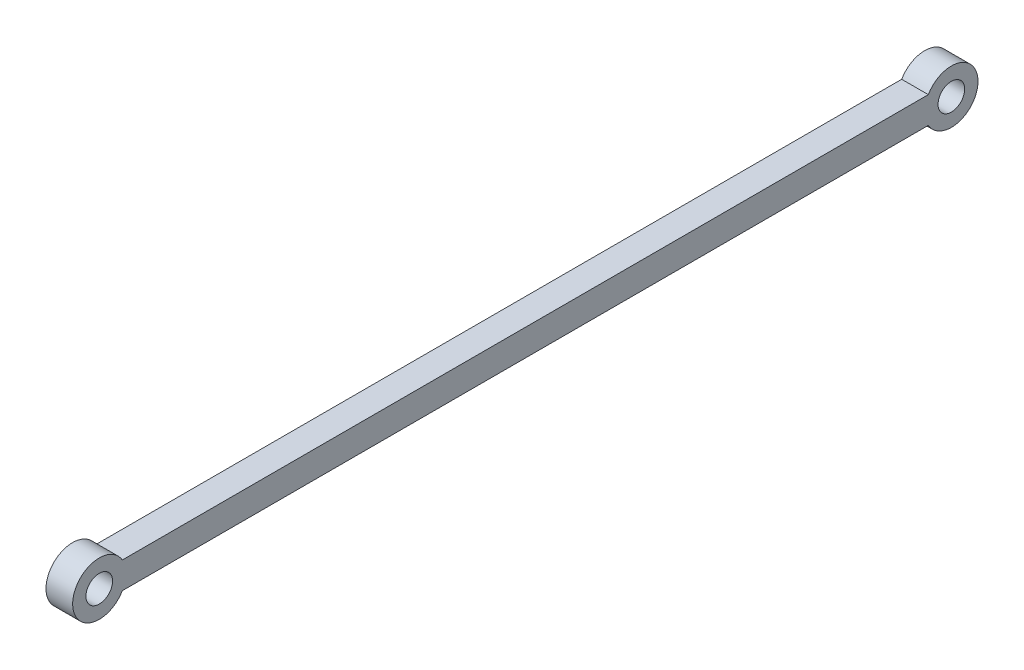
from build123d import *

# Parameters (mm, degrees)
SKETCH_1_R      = 1.25
EXTRUDE_1_DEPTH = 2.5


with BuildPart() as part:
    # 스케치1 → 보스-돌출1 (new body)
    with BuildSketch(Plane(origin=(0, 0, 0), x_dir=(0, 0, -1), z_dir=(1, 0, 0))):
        with BuildLine():
            Line((-37.834936491, 1.25), (37.834936491, 1.25))
            ThreePointArc((37.834936491, 1.25), (42.5, 0), (37.834936491, -1.25))
            Line((37.834936491, -1.25), (-37.834936491, -1.25))
            ThreePointArc((-37.834936491, -1.25), (-42.5, 0), (-37.834936491, 1.25))
        make_face()
        with Locations((-40, 0)):
            Circle(SKETCH_1_R, mode=Mode.SUBTRACT)
        with Locations((40, 0)):
            Circle(SKETCH_1_R, mode=Mode.SUBTRACT)
    extrude(amount=EXTRUDE_1_DEPTH)


solid = part.part
